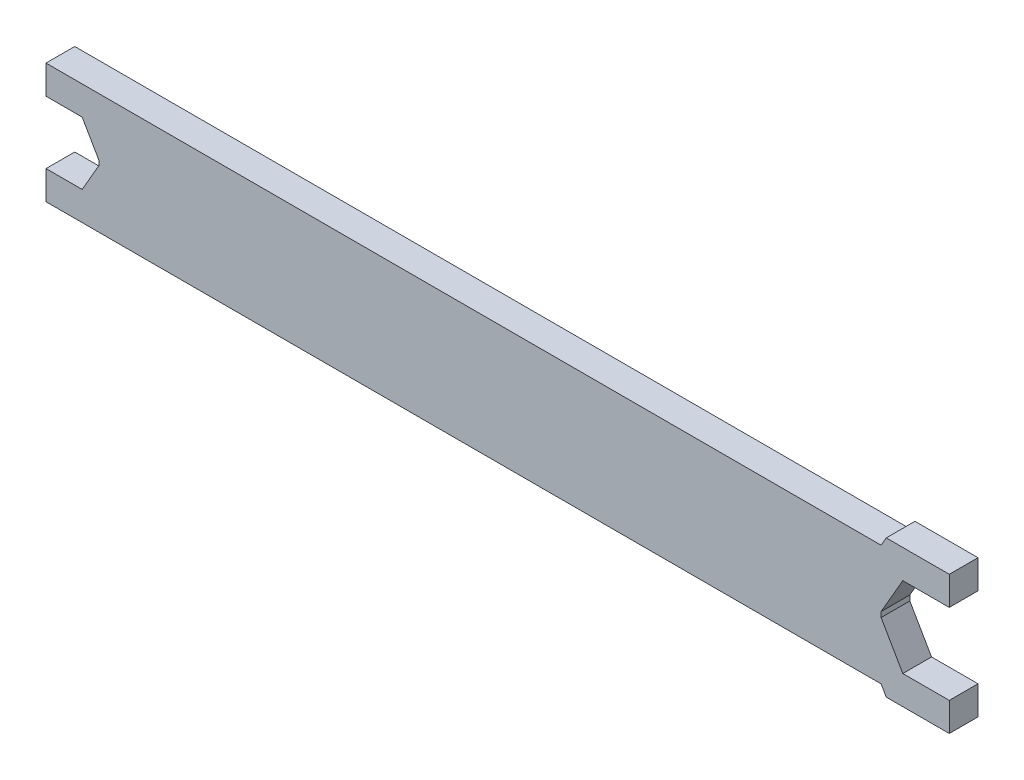
from build123d import *

# Parameters (mm, degrees)
BOSS_EXTRUDE1_DEPTH = 2.54
SKETCH3_W           = 69.160945518
SKETCH3_H           = 10.6172
BOSS_EXTRUDE2_DEPTH = 2.54


with BuildPart() as part:
    # Sketch1 → Boss-Extrude1 (new body)
    with BuildSketch(Plane.XY):
        Polygon((70.693406338, 2.6543), (72.680472759, 6.096), (78.253057557, 6.096), (78.253057557, 3.556), (74.146942443, 3.556), (72.093884886, 0), (74.146942443, -3.556), (78.253057557, -3.556), (78.253057557, -6.096), (72.680472759, -6.096), (70.693406338, -2.6543), (4.597382459, -2.6543), (3.064921639, -5.3086), (-1.598451955, -5.3086), (-1.598451955, -2.7686), (1.598451955, -2.7686), (3.196903911, 0), (1.598451955, 2.7686), (-1.598451955, 2.7686), (-1.598451955, 5.3086), (3.064921639, 5.3086), (4.597382459, 2.6543), align=None)
    extrude(amount=BOSS_EXTRUDE1_DEPTH)

    # Sketch3 → Boss-Extrude2 (add)
    with BuildSketch(Plane.XY.offset(2.54)):
        with Locations((37.645394398, 0)):
            Rectangle(SKETCH3_W, SKETCH3_H)
    extrude(amount=-BOSS_EXTRUDE2_DEPTH)


solid = part.part
